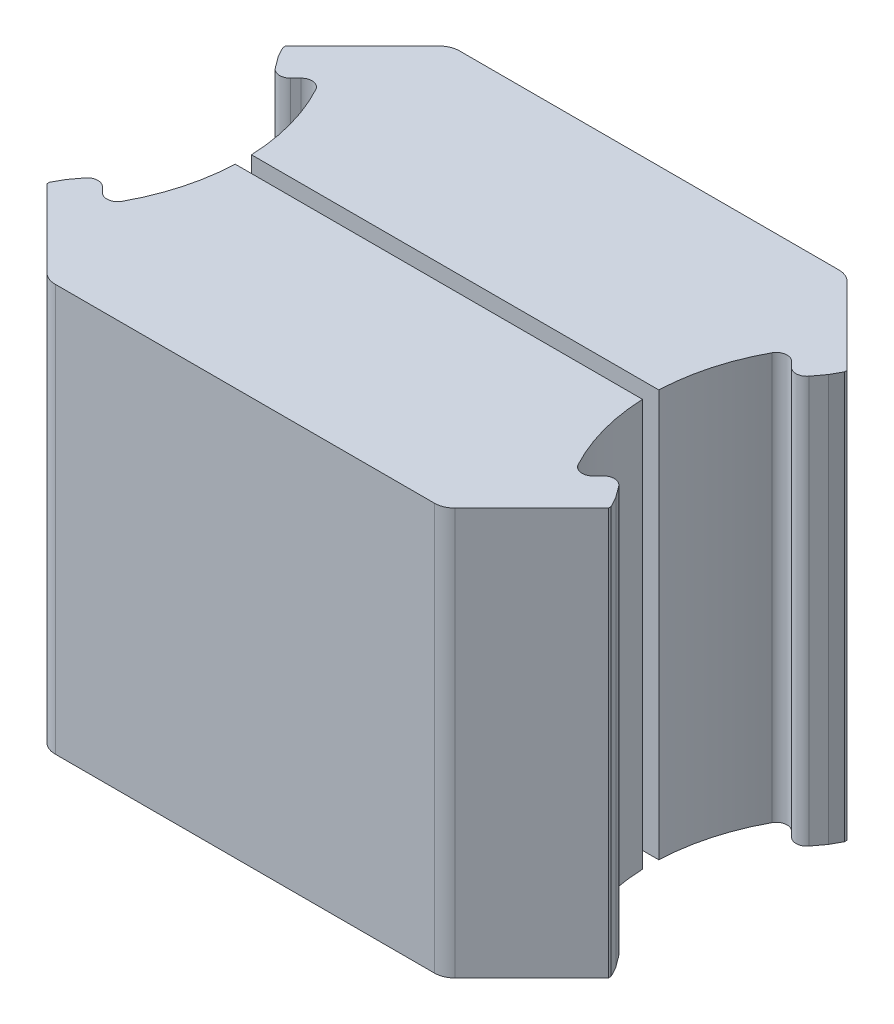
from build123d import *

# Parameters (mm, degrees)
BOSS_EXTRUDE1_DEPTH   = 30
BOSS_EXTRUDE1_2_DEPTH = 30


with BuildPart() as part:
    # Sketch2 → Boss-Extrude1 (new body)
    with BuildSketch(Plane(origin=(0, 0, 0), x_dir=(1, 0, 0), z_dir=(0, 1, 0))):
        with BuildLine():
            Line((-10.070652174, -4.027639752), (-4.409992002, -9.688299923))
            ThreePointArc((-4.409992002, -9.688299923), (-3.923356979, -10.01345905), (-3.34933183, -10.127639752))
            Line((-3.34933183, -10.127639752), (24.608027482, -10.127639752))
            ThreePointArc((24.608027482, -10.127639752), (25.182052631, -10.01345905), (25.668687654, -9.688299923))
            Line((25.668687654, -9.688299923), (31.329347826, -4.027639752))
            Line((31.329347826, -4.027639752), (31.329347826, -3.827111907))
            Line((31.329347826, -3.827111907), (30.915087808, -3.06843312))
            Line((30.915087808, -3.06843312), (30.306332979, -2.247132238))
            ThreePointArc((30.306332979, -2.247132238), (29.722596461, -1.925684234), (29.097945483, -2.157822764))
            Line((29.097945483, -2.157822764), (28.705622633, -2.550145614))
            ThreePointArc((28.705622633, -2.550145614), (28.024545944, -2.776094483), (27.436308441, -2.365126129))
            ThreePointArc((27.436308441, -2.365126129), (26.164654274, 0.800881877), (25.64135263, 4.172360248))
            Line((25.64135263, 4.172360248), (-4.382656977, 4.172360248))
            ThreePointArc((-4.382656977, 4.172360248), (-4.905958622, 0.800881877), (-6.177612789, -2.365126129))
            ThreePointArc((-6.177612789, -2.365126129), (-6.765850292, -2.776094483), (-7.446926981, -2.550145614))
            Line((-7.446926981, -2.550145614), (-7.839249831, -2.157822764))
            ThreePointArc((-7.839249831, -2.157822764), (-8.463900809, -1.925684234), (-9.047637327, -2.247132238))
            Line((-9.047637327, -2.247132238), (-9.518644552, -2.882591098))
            Line((-9.518644552, -2.882591098), (-9.656392156, -3.06843312))
            Line((-9.656392156, -3.06843312), (-9.863522165, -3.447772514))
            Line((-9.863522165, -3.447772514), (-10.070652174, -3.827111907))
            Line((-10.070652174, -3.827111907), (-10.070652174, -4.027639752))
        make_face()
    extrude(amount=BOSS_EXTRUDE1_DEPTH)


with BuildPart() as body_2:
    # Sketch2 → Boss-Extrude1 2 (new body)
    with BuildSketch(Plane(origin=(0, 0, 0), x_dir=(1, 0, 0), z_dir=(0, 1, 0))):
        with BuildLine():
            Line((31.329347826, 13.572360248), (25.668687655, 19.23302042))
            ThreePointArc((25.668687655, 19.23302042), (25.182052631, 19.558179547), (24.608027483, 19.672360248))
            Line((24.608027483, 19.672360248), (-3.34933183, 19.672360248))
            ThreePointArc((-3.34933183, 19.672360248), (-3.923356979, 19.558179547), (-4.409992002, 19.23302042))
            Line((-4.409992002, 19.23302042), (-10.070652174, 13.572360248))
            Line((-10.070652174, 13.572360248), (-10.070652174, 13.371832404))
            Line((-10.070652174, 13.371832404), (-9.656392155, 12.613153617))
            Line((-9.656392155, 12.613153617), (-9.047637327, 11.791852734))
            ThreePointArc((-9.047637327, 11.791852734), (-8.463900808, 11.470404731), (-7.83924983, 11.702543261))
            Line((-7.83924983, 11.702543261), (-7.446926981, 12.09486611))
            ThreePointArc((-7.446926981, 12.09486611), (-6.765850292, 12.32081498), (-6.177612789, 11.909846626))
            ThreePointArc((-6.177612789, 11.909846626), (-4.905958622, 8.743838619), (-4.382656977, 5.372360248))
            Line((-4.382656977, 5.372360248), (25.64135263, 5.372360248))
            ThreePointArc((25.64135263, 5.372360248), (26.164654275, 8.743838618), (27.436308441, 11.909846624))
            ThreePointArc((27.436308441, 11.909846624), (28.024545944, 12.320814978), (28.705622633, 12.094866109))
            Line((28.705622633, 12.094866109), (29.097945483, 11.702543259))
            ThreePointArc((29.097945483, 11.702543259), (29.722596462, 11.47040473), (30.30633298, 11.791852734))
            Line((30.30633298, 11.791852734), (30.777340205, 12.427311595))
            Line((30.777340205, 12.427311595), (30.915087808, 12.613153617))
            Line((30.915087808, 12.613153617), (31.122217817, 12.99249301))
            Line((31.122217817, 12.99249301), (31.329347826, 13.371832404))
            Line((31.329347826, 13.371832404), (31.329347826, 13.572360248))
        make_face()
    extrude(amount=BOSS_EXTRUDE1_2_DEPTH)


solid = Compound([part.part, body_2.part])
